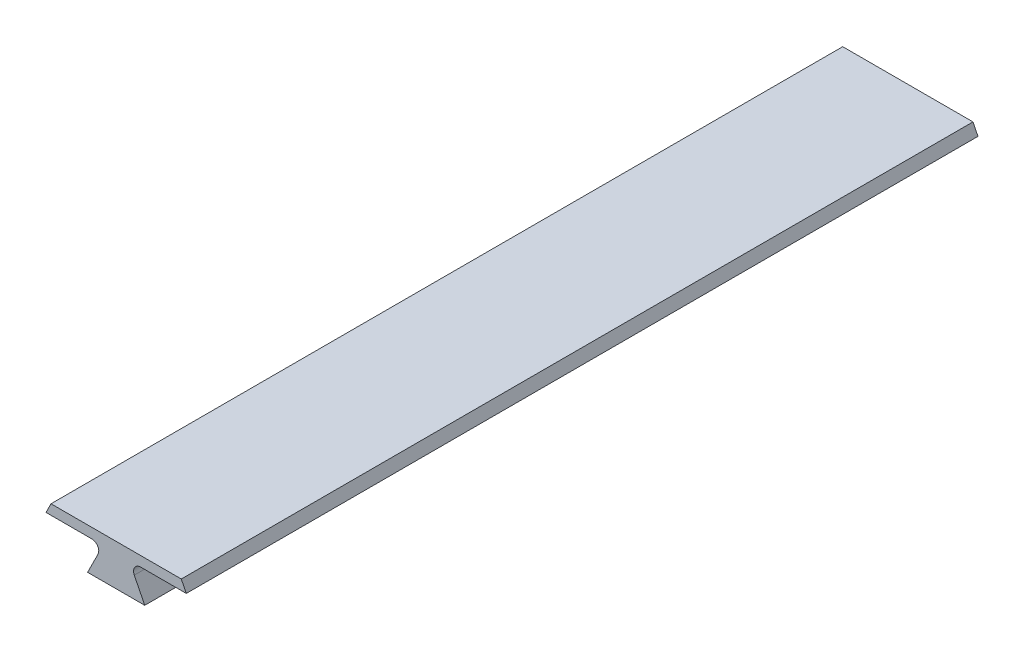
from build123d import *

# Parameters (mm, degrees)
BOSS_EXTRUDE1_DEPTH     = 34.5
CUT_EXTRUDE1_DEPTH      = 59.851529292
CUT_EXTRUDE1_DEPTH_BACK = 59.851529292
SKETCH2_W               = 6.5
SKETCH2_H               = 1.55
BOSS_EXTRUDE2_DEPTH     = 5
FILLET1_R               = 0.2


with BuildPart() as part:
    # Sketch1 → Boss-Extrude1 (new body)
    with BuildSketch(Plane(origin=(0, 0, 0), x_dir=(1, 0, 0), z_dir=(0, 0, -1))):
        with BuildLine():
            Line((-3.5, 46), (-1.217705098, 46))
            ThreePointArc((-1.217705098, 46), (-0.919977315, 46.165994111), (-0.904655581, 46.506524758))
            Line((-0.904655581, 46.506524758), (-1.426393202, 47.55))
            Line((-1.426393202, 47.55), (1.426393202, 47.55))
            Line((1.426393202, 47.55), (0.904655581, 46.506524758))
            ThreePointArc((0.904655581, 46.506524758), (0.919977315, 46.165994111), (1.217705098, 46))
            Line((1.217705098, 46), (3.5, 46))
            Line((3.5, 46), (3.25, 45.5))
            Line((3.25, 45.5), (-3.25, 45.5))
            Line((-3.25, 45.5), (-3.5, 46))
        make_face()
    extrude(amount=BOSS_EXTRUDE1_DEPTH)

    # Sketch2 → Cut-Extrude1 (cut, two sides: drawn at the far end of the back side and taken through both)
    with BuildSketch(Plane(origin=(0, 0, 0), x_dir=(0, 0, -1), z_dir=(1, 0, 0)).offset(-CUT_EXTRUDE1_DEPTH_BACK)):
        with Locations((4.95, -46.775)):
            Rectangle(SKETCH2_W, SKETCH2_H)
        with Locations((29.55, -46.775)):
            Rectangle(SKETCH2_W, SKETCH2_H)
        with Locations((21.35, -46.775)):
            Rectangle(SKETCH2_W, SKETCH2_H)
        with Locations((13.15, -46.775)):
            Rectangle(SKETCH2_W, SKETCH2_H)
    extrude(amount=CUT_EXTRUDE1_DEPTH + CUT_EXTRUDE1_DEPTH_BACK, mode=Mode.SUBTRACT)

    # Sketch3 → Boss-Extrude2 (add)
    with BuildSketch(Plane(origin=(0, 0, -34.5), x_dir=(-1, 0, 0), z_dir=(0, 0, -1))):
        Polygon((1.217705098, -46), (-1.217705098, -46), (-3.5, -46), (-3.25, -45.5), (3.25, -45.5), (3.5, -46), align=None)
    extrude(amount=BOSS_EXTRUDE2_DEPTH)

    # Fillet1
    fillet1_edges = [part.edges().sort_by_distance(p)[0] for p in [
        (0, -46, -26.3),
        (0, -46, -32.8),
        (0, -46, -1.7),
        (0, -46, -8.2),
        (0, -46, -9.9),
        (0, -46, -16.4),
    ]]
    fillet(fillet1_edges, radius=FILLET1_R)


solid = part.part
